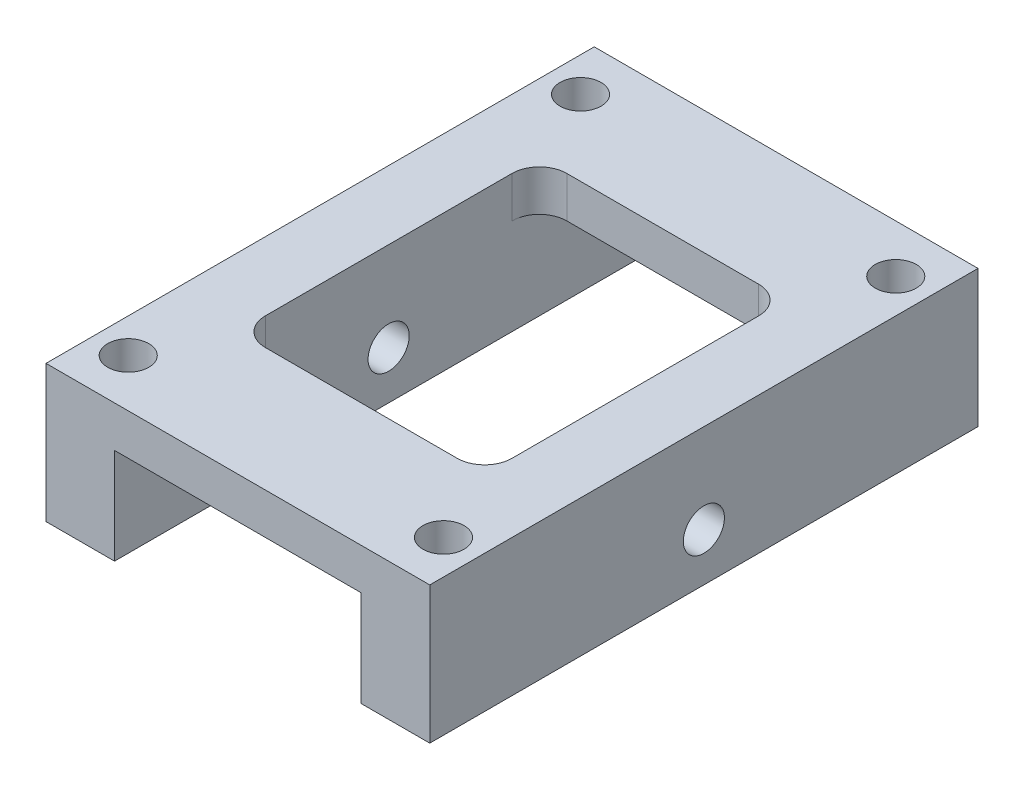
from build123d import *

# Parameters (mm, degrees)
EXTRUDE_1_DEPTH     = 40
SKETCH_2_R          = 1.5
CUT_EXTRUDE_1_DEPTH = 40
SKETCH_3_R          = 1.5
CUT_EXTRUDE_2_DEPTH = 40
SKETCH_5_W          = 18
SKETCH_5_H          = 22
CUT_EXTRUDE_3_DEPTH = 50.839743178
FILLET_3_R          = 2


with BuildPart() as part:
    # 草图1 → 凸台-拉伸1 (new body)
    with BuildSketch(Plane.XY):
        Polygon((0, 0), (0, 10), (28, 10), (28, 0), (23, 0), (23, 7), (5, 7), (5, 0), align=None)
    extrude(amount=EXTRUDE_1_DEPTH)

    # 草图2 → 切除-拉伸1 (cut)
    with BuildSketch(Plane(origin=(0, 10, 0), x_dir=(1, 0, 0), z_dir=(0, 1, 0))):
        with Locations(Location((2.5, -3.5, 0), (0, 0, 270))):
            Circle(SKETCH_2_R)
        with Locations(Location((2.5, -36.5, 0), (0, 0, 270))):
            Circle(SKETCH_2_R)
        with Locations(Location((25.5, -36.5, 0), (0, 0, 270))):
            Circle(SKETCH_2_R)
        with Locations(Location((25.5, -3.5, 0), (0, 0, 270))):
            Circle(SKETCH_2_R)
    extrude(amount=-CUT_EXTRUDE_1_DEPTH, mode=Mode.SUBTRACT)

    # 草图3 → 切除-拉伸2 (cut)
    with BuildSketch(Plane.ZY):
        with Locations((20, 3.5)):
            Circle(SKETCH_3_R)
    extrude(amount=-CUT_EXTRUDE_2_DEPTH, mode=Mode.SUBTRACT)

    # 草图5 → 切除-拉伸3 (cut, through all)
    with BuildSketch(Plane(origin=(0, 10, 0), x_dir=(1, 0, 0), z_dir=(0, 1, 0))):
        with Locations((14, -20)):
            Rectangle(SKETCH_5_W, SKETCH_5_H)
    extrude(amount=-CUT_EXTRUDE_3_DEPTH, mode=Mode.SUBTRACT)

    # 圆角3
    fillet_3_edges = [part.edges().sort_by_distance(p)[0] for p in [
        (23, 8.5, 31),
        (5, 8.5, 9),
        (5, 8.5, 31),
        (23, 8.5, 9),
    ]]
    fillet(fillet_3_edges, radius=FILLET_3_R)


solid = part.part
